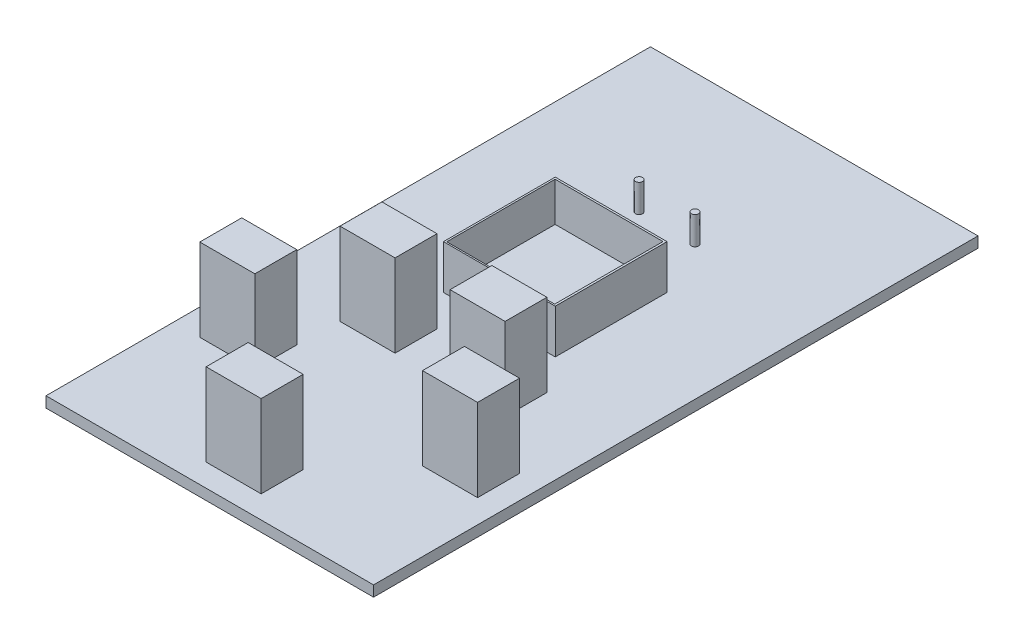
from build123d import *

# Parameters (mm, degrees)
SKETCH1_W             = 101.6
SKETCH1_H             = 101.6
BOSS_EXTRUDE1_DEPTH   = 39.99992
SKETCH2_W             = 98.115054024
SKETCH2_H             = 98.519374302
CUT_EXTRUDE1_DEPTH    = 35.56
SKETCH3_W             = 49.9999
SKETCH3_H             = 37.999924
BOSS_EXTRUDE2_DEPTH   = 75.000104
SKETCH3_W_2           = 50.038
SKETCH3_H_2           = 38.1
BOSS_EXTRUDE2_2_DEPTH = 75.000104
BOSS_EXTRUDE2_3_DEPTH = 75.000104
BOSS_EXTRUDE2_4_DEPTH = 75.000104
SKETCH3_W_3           = 50.044709845
SKETCH3_H_3           = 38.200481576
BOSS_EXTRUDE2_5_DEPTH = 75.000104
SKETCH4_W             = 47.673303357
SKETCH4_H             = 36.001078641
SKETCH4_W_2           = 47.329126014
SKETCH4_H_2           = 35.49131434
SKETCH4_W_3           = 47.385353059
SKETCH4_H_3           = 34.904518915
SKETCH4_W_4           = 47.458878428
SKETCH4_W_5           = 48.104938799
SKETCH4_H_4           = 35.956464733
CUT_EXTRUDE2_DEPTH    = 73.222104
SKETCH5_R             = 9.906
SKETCH5_R_2           = 9.962701018
CUT_EXTRUDE3_DEPTH    = 9.722104
SKETCH6_R             = 9.906
CUT_EXTRUDE4_DEPTH    = 9.722104
SKETCH7_R             = 9.906
CUT_EXTRUDE5_DEPTH    = 9.722104
SKETCH8_W             = 297.716106252
SKETCH8_H             = 549.396882706
BOSS_EXTRUDE4_DEPTH   = 9.722104
SKETCH9_R             = 3.175
BOSS_EXTRUDE5_DEPTH   = 25.4


with BuildPart() as part:
    # Sketch1 → Boss-Extrude1 (new body)
    with BuildSketch(Plane(origin=(0, 0, 0), x_dir=(1, 0, 0), z_dir=(0, 1, 0))):
        with Locations((50.8, 50.8)):
            Rectangle(SKETCH1_W, SKETCH1_H)
    extrude(amount=BOSS_EXTRUDE1_DEPTH)

    # Sketch2 → Cut-Extrude1 (cut)
    with BuildSketch(Plane(origin=(0, 39.99992, 0), x_dir=(1, 0, 0), z_dir=(0, 1, 0))):
        with Locations((50.665226574, 50.597839861)):
            Rectangle(SKETCH2_W, SKETCH2_H)
    extrude(amount=-CUT_EXTRUDE1_DEPTH, mode=Mode.SUBTRACT)



with BuildPart() as body_2:
    # Sketch3 → Boss-Extrude2 (new body)
    with BuildSketch(Plane.XZ):
        with Locations((100.7999508, 50.8000254)):
            Rectangle(SKETCH3_W, SKETCH3_H)
    extrude(amount=-BOSS_EXTRUDE2_DEPTH)


with BuildPart() as body_3:
    # Sketch3 → Boss-Extrude2 2 (new body)
    with BuildSketch(Plane.XZ):
        with Locations((0.7809992, 50.7499874)):
            Rectangle(SKETCH3_W_2, SKETCH3_H_2)
    extrude(amount=-BOSS_EXTRUDE2_2_DEPTH)


with BuildPart() as body_4:
    # Sketch3 → Boss-Extrude2 3 (new body)
    with BuildSketch(Plane.XZ):
        with Locations((152.019, 127)):
            Rectangle(SKETCH3_W_2, SKETCH3_H_2)
    extrude(amount=-BOSS_EXTRUDE2_3_DEPTH)


with BuildPart() as body_5:
    # Sketch3 → Boss-Extrude2 4 (new body)
    with BuildSketch(Plane.XZ):
        with Locations((-50.419, 127)):
            Rectangle(SKETCH3_W_2, SKETCH3_H_2)
    extrude(amount=-BOSS_EXTRUDE2_4_DEPTH)


with BuildPart() as body_6:
    # Sketch3 → Boss-Extrude2 5 (new body)
    with BuildSketch(Plane.XZ):
        with Locations((50.669645078, 222.300240788)):
            Rectangle(SKETCH3_W_3, SKETCH3_H_3)
    extrude(amount=-BOSS_EXTRUDE2_5_DEPTH)


with BuildPart() as cut_extrude2_tool:
    # Sketch4 → Cut-Extrude2 (new body)
    with BuildSketch(Plane.XZ):
        with Locations((-50.459366902, 126.988435685)):
            Rectangle(SKETCH4_W, SKETCH4_H)
        with Locations((0.970104392, 50.412109166)):
            Rectangle(SKETCH4_W_2, SKETCH4_H_2)
        with Locations((100.689433749, 50.705506879)):
            Rectangle(SKETCH4_W_3, SKETCH4_H_3)
        with Locations((152.233471247, 126.988435685)):
            Rectangle(SKETCH4_W_4, SKETCH4_H)
        with Locations((50.616530906, 222.262061552)):
            Rectangle(SKETCH4_W_5, SKETCH4_H_4)
    extrude(amount=-CUT_EXTRUDE2_DEPTH)


with BuildPart() as body_2_1:
    add(body_2.part)

    # Cut-Extrude2: cut by cut_extrude2_tool
    add(cut_extrude2_tool.part, mode=Mode.SUBTRACT)


with BuildPart() as body_3_1:
    add(body_3.part)

    # Cut-Extrude2: cut by cut_extrude2_tool
    add(cut_extrude2_tool.part, mode=Mode.SUBTRACT)


with BuildPart() as body_4_1:
    add(body_4.part)

    # Cut-Extrude2: cut by cut_extrude2_tool
    add(cut_extrude2_tool.part, mode=Mode.SUBTRACT)


with BuildPart() as body_5_1:
    add(body_5.part)

    # Cut-Extrude2: cut by cut_extrude2_tool
    add(cut_extrude2_tool.part, mode=Mode.SUBTRACT)


with BuildPart() as body_6_1:
    add(body_6.part)

    # Cut-Extrude2: cut by cut_extrude2_tool
    add(cut_extrude2_tool.part, mode=Mode.SUBTRACT)

    # Sketch7 → Cut-Extrude5 (cut)
    with BuildSketch(Plane(origin=(0, 0, 203.2), x_dir=(-1, 0, 0), z_dir=(0, 0, -1))):
        with Locations((-50.669645078, 54.934104)):
            Circle(SKETCH7_R)
    extrude(amount=-CUT_EXTRUDE5_DEPTH, mode=Mode.SUBTRACT)


with BuildPart() as cut_extrude3_tool:
    # Sketch5 → Cut-Extrude3 (new body)
    with BuildSketch(Plane(origin=(0, 0, 31.6999874), x_dir=(-1, 0, 0), z_dir=(0, 0, -1))):
        with Locations((-0.7809992, 54.934104)):
            Circle(SKETCH5_R)
        with Locations((-100.7999508, 54.934104)):
            Circle(SKETCH5_R_2)
    extrude(amount=-CUT_EXTRUDE3_DEPTH)


with BuildPart() as body_2_2:
    add(body_2_1.part)

    # Cut-Extrude3: cut by cut_extrude3_tool
    add(cut_extrude3_tool.part, mode=Mode.SUBTRACT)


with BuildPart() as body_3_2:
    add(body_3_1.part)

    # Cut-Extrude3: cut by cut_extrude3_tool
    add(cut_extrude3_tool.part, mode=Mode.SUBTRACT)


with BuildPart() as cut_extrude4_tool:
    # Sketch6 → Cut-Extrude4 (new body)
    with BuildSketch(Plane(origin=(0, 0, 107.95), x_dir=(-1, 0, 0), z_dir=(0, 0, -1))):
        with Locations((-152.019, 54.934104)):
            Circle(SKETCH6_R)
        with Locations((50.419, 54.934104)):
            Circle(SKETCH6_R)
    extrude(amount=-CUT_EXTRUDE4_DEPTH)


with BuildPart() as body_4_2:
    add(body_4_1.part)

    # Cut-Extrude4: cut by cut_extrude4_tool
    add(cut_extrude4_tool.part, mode=Mode.SUBTRACT)


with BuildPart() as body_5_2:
    add(body_5_1.part)

    # Cut-Extrude4: cut by cut_extrude4_tool
    add(cut_extrude4_tool.part, mode=Mode.SUBTRACT)


with BuildPart() as part_1:
    add(part.part)

    add(body_2_2.part)  # Boss-Extrude4 merges body 2

    add(body_3_2.part)  # Boss-Extrude4 merges body 3

    add(body_4_2.part)  # Boss-Extrude4 merges body 4

    add(body_5_2.part)  # Boss-Extrude4 merges body 5

    add(body_6_1.part)  # Boss-Extrude4 merges body 6
    # Sketch8 → Boss-Extrude4 (add)
    with BuildSketch(Plane.XZ):
        with Locations((49.547758626, -12.735627368)):
            Rectangle(SKETCH8_W, SKETCH8_H)
    extrude(amount=BOSS_EXTRUDE4_DEPTH)

    # Sketch9 → Boss-Extrude5 (add)
    with BuildSketch(Plane(origin=(0, 0, 0), x_dir=(1, 0, 0), z_dir=(0, 1, 0))):
        with Locations(Location((25.4, 152.4, 0), (0, 0, 90))):
            Circle(SKETCH9_R)
        with Locations(Location((76.2, 152.4, 0), (0, 0, 90))):
            Circle(SKETCH9_R)
    extrude(amount=BOSS_EXTRUDE5_DEPTH)


solid = part_1.part
